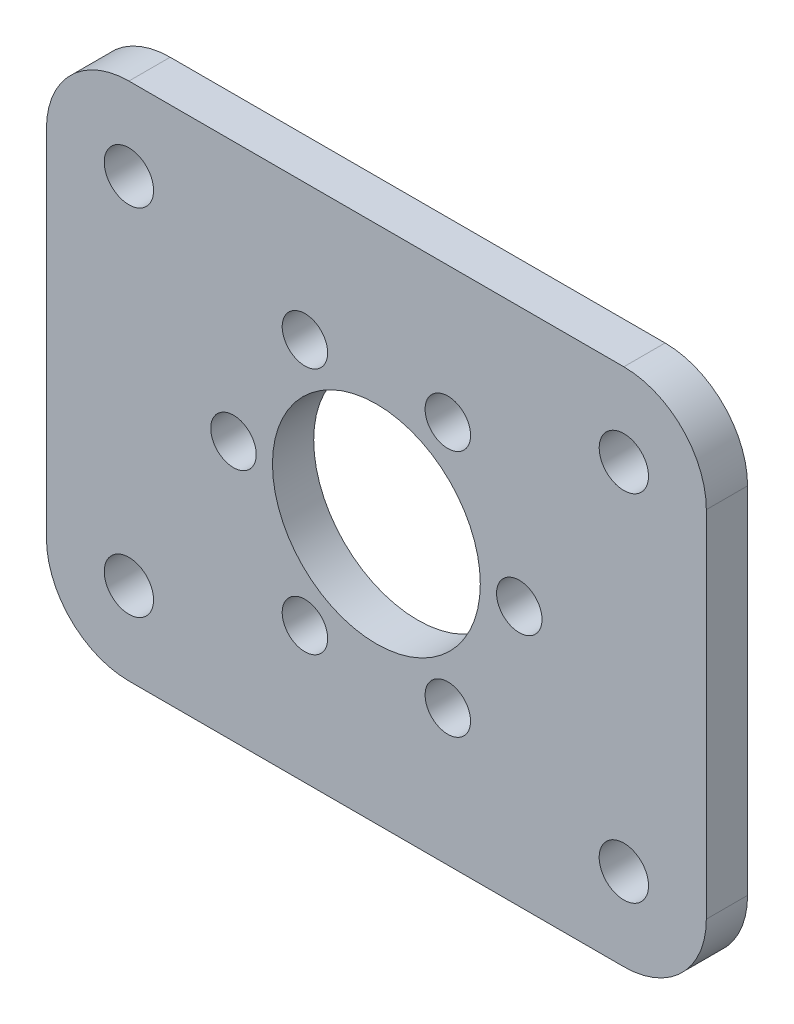
from build123d import *

# Parameters (mm, degrees)
SKETCH1_W           = 50.8
SKETCH1_H           = 40
SKETCH1_R           = 8
BOSS_EXTRUDE1_DEPTH = 3.175
FILLET1_R           = 6.35
SKETCH9_R           = 1.75
M3_THROUGH_DEPTH    = 33.484467442
SKETCH10_R          = 1.89865
CUT_EXTRUDE2_DEPTH  = 33.484467442


with BuildPart() as part:
    # Sketch1 → Boss-Extrude1 (new body)
    with BuildSketch(Plane.XY):
        Rectangle(SKETCH1_W, SKETCH1_H)
        Circle(SKETCH1_R, mode=Mode.SUBTRACT)
    extrude(amount=BOSS_EXTRUDE1_DEPTH)

    # Fillet1
    fillet1_edges = [part.edges().sort_by_distance(p)[0] for p in [
        (-25.4, 20, 1.5875),
        (25.4, 20, 1.5875),
        (25.4, -20, 1.5875),
        (-25.4, -20, 1.5875),
    ]]
    fillet(fillet1_edges, radius=FILLET1_R)

    # Sketch9 → M3-through (cut, through all)
    with BuildSketch(Plane.XY.offset(3.175)):
        with Locations((11, 0)):
            Circle(SKETCH9_R)
        with Locations((5.5, -9.526279442)):
            Circle(SKETCH9_R)
        with Locations((-5.5, -9.526279442)):
            Circle(SKETCH9_R)
        with Locations((-11, 0)):
            Circle(SKETCH9_R)
        with Locations((-5.5, 9.526279442)):
            Circle(SKETCH9_R)
        with Locations((5.5, 9.526279442)):
            Circle(SKETCH9_R)
    extrude(amount=-M3_THROUGH_DEPTH, mode=Mode.SUBTRACT)

    # Sketch10 → Cut-Extrude2 (cut, through all)
    with BuildSketch(Plane.XY.offset(3.175)):
        with Locations((19.05, -13.65)):
            Circle(SKETCH10_R)
        with Locations(Location((19.05, 13.65, 0), (0, 0, 180))):
            Circle(SKETCH10_R)
        with Locations(Location((-19.05, -13.65, 0), (0, 0, 180))):
            Circle(SKETCH10_R)
        with Locations((-19.05, 13.65)):
            Circle(SKETCH10_R)
    extrude(amount=-CUT_EXTRUDE2_DEPTH, mode=Mode.SUBTRACT)


solid = part.part
